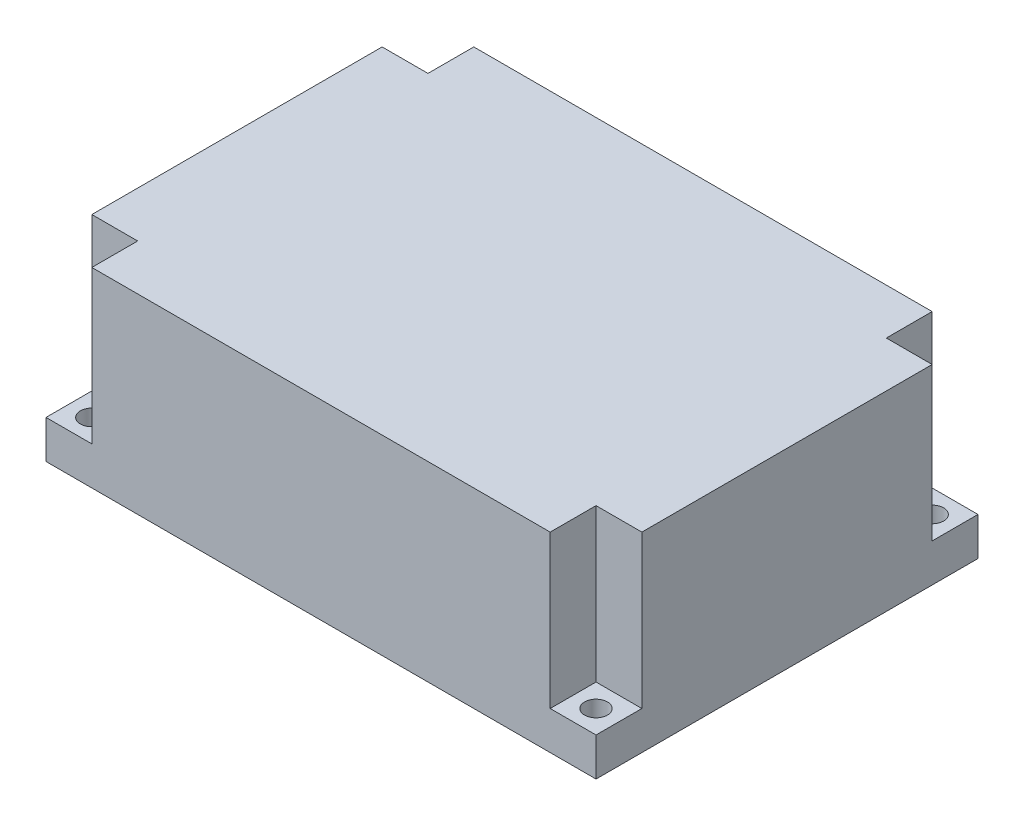
from build123d import *

# Parameters (mm, degrees)
SKETCH_1_W          = 72
SKETCH_1_H          = 50
EXTRUDE_1_DEPTH     = 25
SKETCH_3_R          = 1.5
CUT_EXTRUDE_1_DEPTH = 51.457903246
SKETCH_4_W          = 6
SKETCH_4_H          = 6
CUT_EXTRUDE_2_DEPTH = 20


with BuildPart() as part:
    # 草图1 → 凸台-拉伸1 (new body)
    with BuildSketch(Plane(origin=(0, 0, 0), x_dir=(1, 0, 0), z_dir=(0, 1, 0))):
        Rectangle(SKETCH_1_W, SKETCH_1_H)
    extrude(amount=EXTRUDE_1_DEPTH)

    # 草图3 → 切除-拉伸1 (cut, through all)
    with BuildSketch(Plane(origin=(0, 25, 0), x_dir=(1, 0, 0), z_dir=(0, 1, 0))):
        with Locations(Location((-33, 22, 0), (0, 0, 270))):
            Circle(SKETCH_3_R)
        with Locations(Location((33, 22, 0), (0, 0, 90))):
            Circle(SKETCH_3_R)
        with Locations(Location((33, -22, 0), (0, 0, 270))):
            Circle(SKETCH_3_R)
        with Locations(Location((-33, -22, 0), (0, 0, 90))):
            Circle(SKETCH_3_R)
    extrude(amount=-CUT_EXTRUDE_1_DEPTH, mode=Mode.SUBTRACT)

    # 草图4 → 切除-拉伸2 (cut)
    with BuildSketch(Plane(origin=(0, 25, 0), x_dir=(1, 0, 0), z_dir=(0, 1, 0))):
        with Locations((-33, 22)):
            Rectangle(SKETCH_4_W, SKETCH_4_H)
        with Locations((33, 22)):
            Rectangle(SKETCH_4_W, SKETCH_4_H)
        with Locations((33, -22)):
            Rectangle(SKETCH_4_W, SKETCH_4_H)
        with Locations((-33, -22)):
            Rectangle(SKETCH_4_W, SKETCH_4_H)
    extrude(amount=-CUT_EXTRUDE_2_DEPTH, mode=Mode.SUBTRACT)


solid = part.part
